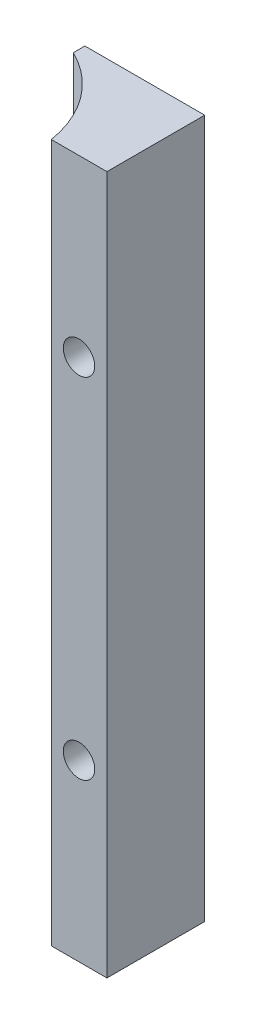
from build123d import *

# Parameters (mm, degrees)
BOSS_EXTRUDE1_DEPTH        = 60
F_2_7_2_7_DIAMETER_HOLE1_D = 2.7


with BuildPart() as part:
    # Sketch1 → Boss-Extrude1 (new body)
    with BuildSketch(Plane(origin=(0, 0, 0), x_dir=(1, 0, 0), z_dir=(0, 1, 0))):
        with BuildLine():
            Line((0, 0), (0, 8.4))
            Line((0, 8.4), (-10.2922712, 8.4))
            Line((-10.2922712, 8.4), (-10.2922712, 7.4))
            ThreePointArc((-10.2922712, 7.4), (-6.631586828, 4.373799749), (-4.78, 0))
            Line((-4.78, 0), (0, 0))
        make_face()
    extrude(amount=BOSS_EXTRUDE1_DEPTH)

    # Ø2.7 (2.7) Diameter Hole1 (through all)
    with Locations(Plane(origin=(-2.4, 45, 0), x_dir=(1, 0, 0), z_dir=(0, 0, 1))):
        with Locations((0, 0), (0, -30)):
            Hole(F_2_7_2_7_DIAMETER_HOLE1_D / 2)


solid = part.part
